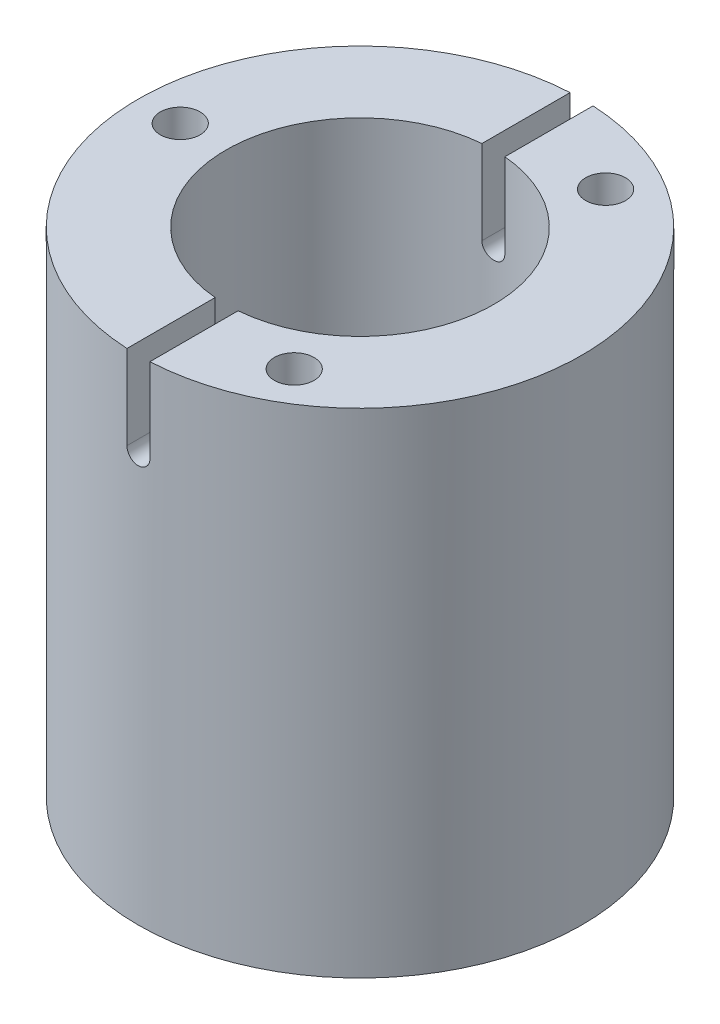
from build123d import *

# Parameters (mm, degrees)
IZIM1_R                                           = 29
Y_KSEKLIK_EKSTR_ZYON1_DEPTH                       = 64.5
IZIM2_R                                           = 17.5
KES_EKSTR_ZYON1_DEPTH                             = 59.5
F_5_0_5_AP_DELIK1_D                               = 5
F_5_0_5_AP_DELIK1_DEPTH                           = 6
F_5_0_5_AP_DELIK1_TIP                             = 0.909925586
PAH1_SIZE                                         = 0.5
PAH2_SIZE                                         = 1
KES_EKSTR_ZYON2_DEPTH                             = 92.461740635
IZIM15_W                                          = 3
IZIM15_H                                          = 10
KES_EKSTR_ZYON4_DEPTH                             = 92.461740801
M5_ALT_GEN_ALYAN_BA_L_K_R_VIDA_IN_HAV_D           = 5.2
M5_ALT_GEN_ALYAN_BA_L_K_R_VIDA_IN_HAV_DEPTH       = 87.053677391
M5_ALT_GEN_ALYAN_BA_L_K_R_VIDA_IN_HAV_CBORE_D     = 9
M5_ALT_GEN_ALYAN_BA_L_K_R_VIDA_IN_HAV_CBORE_DEPTH = 6
M5_ALT_GEN_ALYAN_BA_L_K_R_VIDA_IN_HAV_TIP         = 0.946322609


with BuildPart() as part:
    # Çizim1 → Yükseklik-Ekstrüzyon1 (new body)
    with BuildSketch(Plane(origin=(0, 0, 0), x_dir=(1, 0, 0), z_dir=(0, 1, 0))):
        with Locations(Location((0, 0, 0), (0, 0, 270))):
            Circle(IZIM1_R)
    extrude(amount=Y_KSEKLIK_EKSTR_ZYON1_DEPTH)

    # Çizim2 → Kes-Ekstrüzyon1 (cut)
    with BuildSketch(Plane(origin=(0, 64.5, 0), x_dir=(1, 0, 0), z_dir=(0, 1, 0))):
        with Locations(Location((0, 0, 0), (0, 0, 270))):
            Circle(IZIM2_R)
    extrude(amount=-KES_EKSTR_ZYON1_DEPTH, mode=Mode.SUBTRACT)

    # Ø5.0 (5) Çap Delik1
    with Locations(Plane(origin=(0, 0, 0), x_dir=(-1, 0, 0), z_dir=(0, -1, 0))):
        with Locations((0, 0)):
            Hole(F_5_0_5_AP_DELIK1_D / 2, depth=F_5_0_5_AP_DELIK1_DEPTH)
            with Locations((0, 0, -(F_5_0_5_AP_DELIK1_DEPTH + F_5_0_5_AP_DELIK1_TIP / 2))):  # 140° drill point
                Cone(0, F_5_0_5_AP_DELIK1_D / 2, F_5_0_5_AP_DELIK1_TIP, mode=Mode.SUBTRACT)

    # Pah1
    pah1_edges = [part.edges().sort_by_distance(p)[0] for p in [
        (-2.5, 0, 0),
    ]]
    chamfer(pah1_edges, length=PAH1_SIZE)

    # Pah2
    pah2_edges = [part.edges().sort_by_distance(p)[0] for p in [
        (-2.5, 5, 0),
    ]]
    chamfer(pah2_edges, length=PAH2_SIZE)

    # Çizim6 → Kes-Ekstrüzyon2 (cut, through all)
    with BuildSketch(Plane.XY.offset(29)):
        with BuildLine():
            Line((-1.5, 53.5), (-1.5, 55.5))
            ThreePointArc((-1.5, 55.5), (0, 57), (1.5, 55.5))
            Line((1.5, 55.5), (1.5, 53.5))
            ThreePointArc((1.5, 53.5), (0, 52), (-1.5, 53.5))
        make_face()
    extrude(amount=-KES_EKSTR_ZYON2_DEPTH, mode=Mode.SUBTRACT)

    # Çizim15 → Kes-Ekstrüzyon4 (cut, through all)
    with BuildSketch(Plane.XY.offset(29)):
        with Locations((0, 59.5)):
            Rectangle(IZIM15_W, IZIM15_H)
    extrude(amount=-KES_EKSTR_ZYON4_DEPTH, mode=Mode.SUBTRACT)

    # M5 Altıgen Alyan Başlı Kör Vida İçin Havşa2
    with Locations(Plane(origin=(11.75, 0, 20.351596989), x_dir=(0, 0, -1), z_dir=(0, -1, 0))):
        with Locations((0, 0), (40.703193978, 0), (20.351596989, -35.25)):
            CounterBoreHole(M5_ALT_GEN_ALYAN_BA_L_K_R_VIDA_IN_HAV_D / 2, M5_ALT_GEN_ALYAN_BA_L_K_R_VIDA_IN_HAV_CBORE_D / 2, M5_ALT_GEN_ALYAN_BA_L_K_R_VIDA_IN_HAV_CBORE_DEPTH, depth=M5_ALT_GEN_ALYAN_BA_L_K_R_VIDA_IN_HAV_DEPTH)
            with Locations((0, 0, -(M5_ALT_GEN_ALYAN_BA_L_K_R_VIDA_IN_HAV_DEPTH + M5_ALT_GEN_ALYAN_BA_L_K_R_VIDA_IN_HAV_TIP / 2))):  # 140° drill point
                Cone(0, M5_ALT_GEN_ALYAN_BA_L_K_R_VIDA_IN_HAV_D / 2, M5_ALT_GEN_ALYAN_BA_L_K_R_VIDA_IN_HAV_TIP, mode=Mode.SUBTRACT)


solid = part.part
